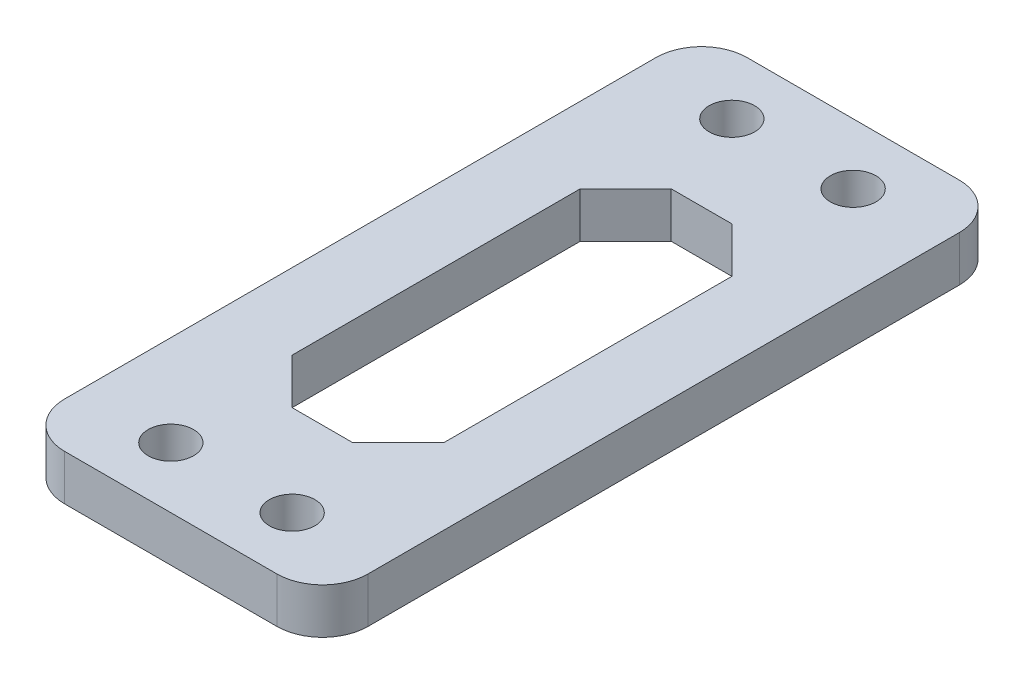
from build123d import *

# Parameters (mm, degrees)
SKETCH_1_W      = 20
SKETCH_1_H      = 45
SKETCH_1_R      = 1.5
SKETCH_1_W_2    = 10
SKETCH_1_H_2    = 25
EXTRUDE_1_DEPTH = 3
CHAMFER_1_SIZE  = 3
FILLET_1_R      = 3


with BuildPart() as part:
    # 草图1 → 凸台-拉伸1 (new body)
    with BuildSketch(Plane(origin=(0, 0, 0), x_dir=(1, 0, 0), z_dir=(0, 1, 0))):
        Rectangle(SKETCH_1_W, SKETCH_1_H)
        with Locations(Location((-4, 18.5, 0), (0, 0, 270))):
            Circle(SKETCH_1_R, mode=Mode.SUBTRACT)
        with Locations(Location((4, 18.5, 0), (0, 0, 90))):
            Circle(SKETCH_1_R, mode=Mode.SUBTRACT)
        with Locations(Location((4, -18.5, 0), (0, 0, 270))):
            Circle(SKETCH_1_R, mode=Mode.SUBTRACT)
        with Locations(Location((-4, -18.5, 0), (0, 0, 90))):
            Circle(SKETCH_1_R, mode=Mode.SUBTRACT)
        Rectangle(SKETCH_1_W_2, SKETCH_1_H_2, mode=Mode.SUBTRACT)
    extrude(amount=EXTRUDE_1_DEPTH)

    # 倒角1
    chamfer_1_edges = [part.edges().sort_by_distance(p)[0] for p in [
        (5, 1.5, 12.5),
        (5, 1.5, -12.5),
        (-5, 1.5, -12.5),
        (-5, 1.5, 12.5),
    ]]
    chamfer(chamfer_1_edges, length=CHAMFER_1_SIZE)

    # 圆角1
    fillet_1_edges = [part.edges().sort_by_distance(p)[0] for p in [
        (10, 1.5, 22.5),
        (-10, 1.5, 22.5),
        (-10, 1.5, -22.5),
        (10, 1.5, -22.5),
    ]]
    fillet(fillet_1_edges, radius=FILLET_1_R)


solid = part.part
